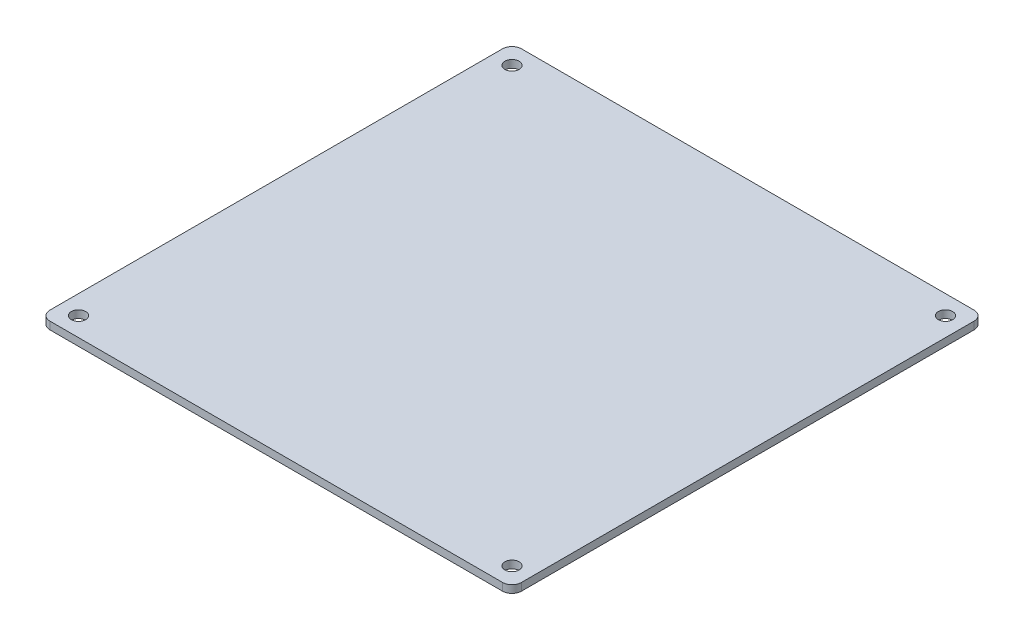
from build123d import *

# Parameters (mm, degrees)
SKETCH_1_W      = 99
SKETCH_1_H      = 99
SKETCH_1_R      = 1.5
EXTRUDE_1_DEPTH = 1.6
FILLET_1_R      = 2


with BuildPart() as part:
    # 草图1 → 凸台-拉伸1 (new body)
    with BuildSketch(Plane(origin=(0, 0, 0), x_dir=(1, 0, 0), z_dir=(0, 1, 0))):
        Rectangle(SKETCH_1_W, SKETCH_1_H)
        with Locations(Location((-45.5, 45.5, 0), (0, 0, 270))):
            Circle(SKETCH_1_R, mode=Mode.SUBTRACT)
        with Locations(Location((45.5, 45.5, 0), (0, 0, 90))):
            Circle(SKETCH_1_R, mode=Mode.SUBTRACT)
        with Locations(Location((45.5, -45.5, 0), (0, 0, 270))):
            Circle(SKETCH_1_R, mode=Mode.SUBTRACT)
        with Locations(Location((-45.5, -45.5, 0), (0, 0, 90))):
            Circle(SKETCH_1_R, mode=Mode.SUBTRACT)
    extrude(amount=EXTRUDE_1_DEPTH)

    # 圆角1
    fillet_1_edges = [part.edges().sort_by_distance(p)[0] for p in [
        (49.5, 0.8, 49.5),
        (-49.5, 0.8, 49.5),
        (-49.5, 0.8, -49.5),
        (49.5, 0.8, -49.5),
    ]]
    fillet(fillet_1_edges, radius=FILLET_1_R)


solid = part.part
